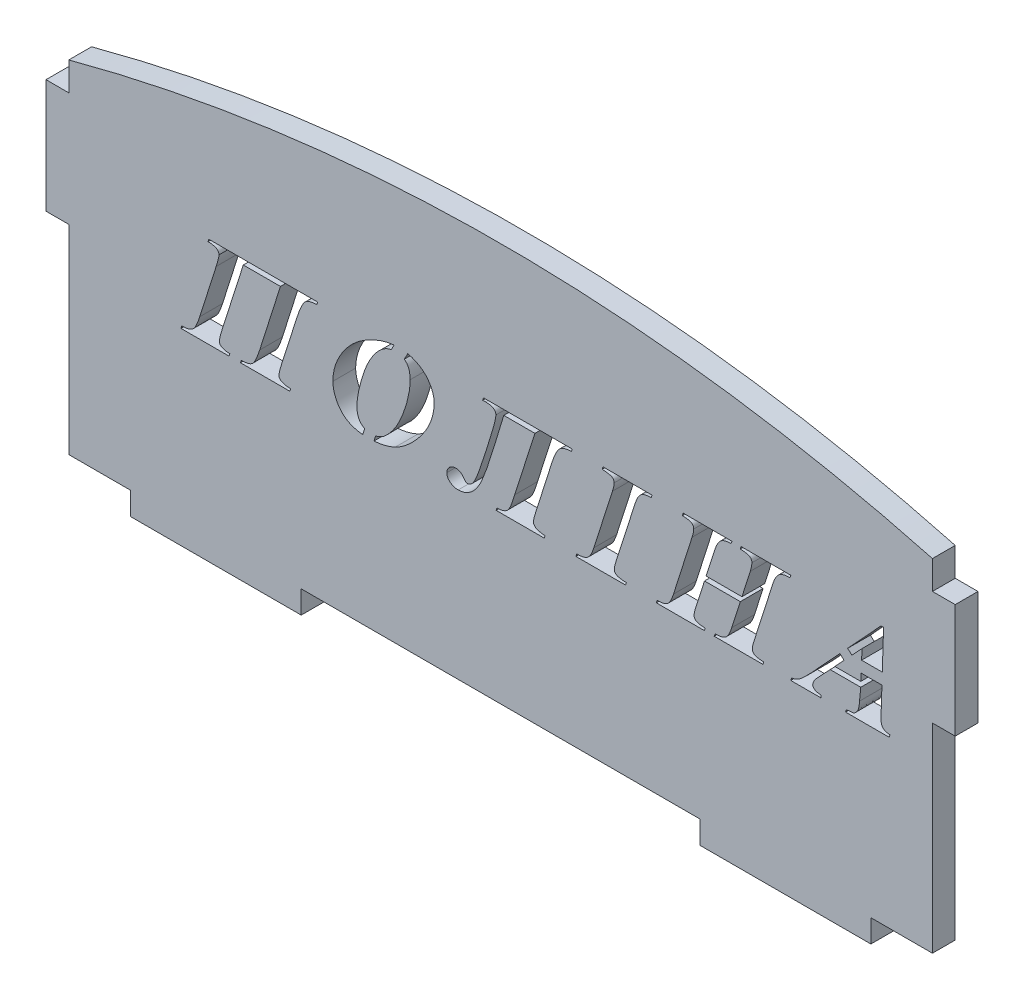
from build123d import *

# Parameters (mm, degrees)
SKETCH_1_W          = 30
SKETCH_1_H          = 4
SKETCH_1_W_2        = 4
SKETCH_1_H_2        = 20
EXTRUDE_1_DEPTH     = 4
CUT_EXTRUDE_1_DEPTH = 171.667395832
EXTRUDE_2_DEPTH     = 4


with BuildPart() as part:
    # Эскиз1 → Бобышка-Вытянуть1 (new body)
    with BuildSketch(Plane.XY):
        with BuildLine():
            ThreePointArc((0, 60), (75.8, 70), (151.6, 60))
            Line((151.6, 60), (151.6, 0))
            Line((151.6, 0), (0, 0))
            Line((0, 0), (0, 60))
        make_face()
        with Locations((25.8, -2)):
            Rectangle(SKETCH_1_W, SKETCH_1_H)
        with Locations((125.8, -2)):
            Rectangle(SKETCH_1_W, SKETCH_1_H)
        with Locations((-2, 45)):
            Rectangle(SKETCH_1_W_2, SKETCH_1_H_2)
        with Locations((153.6, 45)):
            Rectangle(SKETCH_1_W_2, SKETCH_1_H_2)
    extrude(amount=EXTRUDE_1_DEPTH)

    # Эскиз2 → Вырез-Вытянуть1 (cut, through all)
    # profile 1 of 6: a face of its own
    with BuildSketch(Plane.XY.offset(4)):
        with BuildLine():
            Line((24.577777778, 45.033561224), (43.688888889, 45.033561224))
            Line((43.688888889, 45.033561224), (43.560416667, 44.58911678))
            add(Edge.make_bspline(
                [(43.560416667, 44.58911678), (43.422573317, 44.581436375), (43.157719587, 44.56667916), (42.777443925, 44.520166149), (42.433427294, 44.444183595), (42.124413616, 44.344322742), (41.852446958, 44.218410528), (41.61153867, 44.074350744), (41.410902799, 43.897747493), (41.243672908, 43.692460863), (41.098482404, 43.456632733), (40.952262669, 43.190822398), (40.802483546, 42.889064415), (40.656640494, 42.547217024), (40.496813408, 42.173764821), (40.347197166, 41.758239061), (40.18998724, 41.307133263), (40.088672555, 40.992124662), (40.036111111, 40.828700113)],
                knots=[0, 0, 0, 0, 1.165264992, 2.23895298, 3.229786544, 4.135036914, 4.974355311, 5.755229405, 6.496018731, 7.217816154, 7.982134479, 8.830502393, 9.77865426, 10.824236485, 11.967337008, 13.206906941, 14.550960284, 16, 16, 16, 16], degree=3))
            Line((40.036111111, 40.828700113), (37.313888889, 32.293977891))
            add(Edge.make_bspline(
                [(37.313888889, 32.293977891), (37.280906823, 32.187664662), (37.217632677, 31.983709014), (37.136075295, 31.688858548), (37.061667821, 31.422171042), (37.002760192, 31.182483794), (36.955899617, 30.969668405), (36.926255078, 30.782785453), (36.902067301, 30.622124723), (36.898742048, 30.523213571), (36.897222222, 30.478005668)],
                knots=[0, 0, 0, 0, 1.430195329, 2.743745252, 3.930719129, 4.987578332, 5.915147374, 6.729316849, 7.419227069, 8, 8, 8, 8], degree=3))
            add(Edge.make_bspline(
                [(36.897222222, 30.478005668), (36.902406699, 30.404867824), (36.912624859, 30.26071938), (37.021332396, 30.065140051), (37.183652055, 29.895677071), (37.416590081, 29.763014092), (37.705141375, 29.649710838), (38.058307345, 29.566126855), (38.471678594, 29.503722935), (38.769651717, 29.486947188), (38.928472222, 29.478005668)],
                knots=[0, 0, 0, 0, 0.702343681, 1.384259415, 2.113725787, 2.953924595, 3.955253759, 5.110818597, 6.460058258, 8, 8, 8, 8], degree=3))
            Line((38.928472222, 29.478005668), (38.8, 29.033561224))
            Line((38.8, 29.033561224), (30.133333333, 29.033561224))
            Line((30.133333333, 29.033561224), (30.272222222, 29.478005668))
            add(Edge.make_bspline(
                [(30.272222222, 29.478005668), (30.391450971, 29.480563315), (30.619745459, 29.485460597), (30.948428258, 29.50701051), (31.247082477, 29.554307437), (31.519017307, 29.609666247), (31.760143211, 29.689490797), (31.96979695, 29.78813057), (32.154844192, 29.896918566), (32.31044256, 30.037439763), (32.454295846, 30.208373948), (32.594320912, 30.421959595), (32.740561494, 30.680535272), (32.887861593, 30.986456139), (33.041079952, 31.338430092), (33.195625636, 31.737497054), (33.356197092, 32.182975836), (33.458319628, 32.49737119), (33.511805556, 32.662033446)],
                knots=[0, 0, 0, 0, 1.130023369, 2.163723997, 3.117553014, 3.993016472, 4.790632551, 5.516740744, 6.186323123, 6.815629206, 7.492446661, 8.298462087, 9.231577466, 10.305673929, 11.513826383, 12.868083061, 14.359681528, 16, 16, 16, 16], degree=3))
            Line((33.511805556, 32.662033446), (37.150694444, 44.144672335))
            Line((37.150694444, 44.144672335), (30.633333333, 44.144672335))
            Line((30.633333333, 44.144672335), (26.914583333, 32.467589002))
            add(Edge.make_bspline(
                [(26.914583333, 32.467589002), (26.877186226, 32.345008269), (26.80568995, 32.110656831), (26.709035781, 31.773685785), (26.623761817, 31.469991539), (26.56104176, 31.197821125), (26.49968265, 30.962363052), (26.469383631, 30.757116517), (26.439709271, 30.586457221), (26.436743226, 30.482730592), (26.435416667, 30.436339002)],
                knots=[0, 0, 0, 0, 1.470386622, 2.81110425, 4.022393801, 5.088493372, 6.016169153, 6.810842172, 7.468150825, 8, 8, 8, 8], degree=3))
            add(Edge.make_bspline(
                [(26.435416667, 30.436339002), (26.439969258, 30.364678039), (26.448858214, 30.224759659), (26.544099099, 30.03068058), (26.695838621, 29.867794159), (26.905213141, 29.736357008), (27.166784692, 29.628688617), (27.486703486, 29.553065539), (27.861882979, 29.497251819), (28.131942379, 29.4846915), (28.275694444, 29.478005668)],
                knots=[0, 0, 0, 0, 0.746538604, 1.457620257, 2.213469515, 3.054867674, 4.028423999, 5.167380879, 6.492202649, 8, 8, 8, 8], degree=3))
            Line((28.275694444, 29.478005668), (28.133333333, 29.033561224))
            Line((28.133333333, 29.033561224), (19.688888889, 29.033561224))
            Line((19.688888889, 29.033561224), (19.83125, 29.478005668))
            add(Edge.make_bspline(
                [(19.83125, 29.478005668), (19.9389481, 29.481557788), (20.147727633, 29.488443796), (20.447993442, 29.515906128), (20.725248245, 29.557232852), (20.979146959, 29.613107654), (21.212126131, 29.67904485), (21.41806279, 29.769270557), (21.604808373, 29.863941831), (21.772008688, 29.983353968), (21.925811514, 30.136841814), (22.078301857, 30.328257296), (22.227700917, 30.569645025), (22.377627951, 30.85759473), (22.534983937, 31.189912115), (22.685454228, 31.571860876), (22.843062845, 31.998268226), (22.940113975, 32.301657682), (22.990972222, 32.460644557)],
                knots=[0, 0, 0, 0, 1.072010987, 2.078160646, 2.998388562, 3.8590385, 4.664277817, 5.40222355, 6.092532591, 6.744504629, 7.436732265, 8.247879266, 9.174426911, 10.256290016, 11.477294972, 12.830993111, 14.339327581, 16, 16, 16, 16], degree=3))
            Line((22.990972222, 32.460644557), (25.869444444, 41.537033446))
            add(Edge.make_bspline(
                [(25.869444444, 41.537033446), (25.908217438, 41.657224396), (25.982185109, 41.88651401), (26.078855019, 42.216956539), (26.161631825, 42.514577823), (26.233161584, 42.778867946), (26.285035718, 43.012028981), (26.323138991, 43.213445053), (26.350811753, 43.38234615), (26.354103742, 43.484873139), (26.355555556, 43.530089002)],
                knots=[0, 0, 0, 0, 1.473799708, 2.811584128, 4.017612185, 5.079130301, 6.006533427, 6.803931455, 7.472516732, 8, 8, 8, 8], degree=3))
            add(Edge.make_bspline(
                [(26.355555556, 43.530089002), (26.349868104, 43.613216186), (26.338837873, 43.774432844), (26.242780865, 43.99891033), (26.08780418, 44.188741551), (25.870068821, 44.340678217), (25.593016192, 44.451631339), (25.260102934, 44.533784448), (24.867230941, 44.579872565), (24.586000439, 44.585893105), (24.435416667, 44.58911678)],
                knots=[0, 0, 0, 0, 0.810382873, 1.571654571, 2.344460079, 3.180311087, 4.13931611, 5.248819674, 6.526891263, 8, 8, 8, 8], degree=3))
            Line((24.435416667, 44.58911678), (24.577777778, 45.033561224))
        make_face()
    # profile 2 of 6: a face of its own
    with BuildSketch(Plane.XY.offset(4)):
        with BuildLine():
            add(Edge.make_bspline(
                [(52.452777778, 28.811339002), (52.277913253, 28.812525445), (51.9369921, 28.814838569), (51.440132214, 28.856330407), (50.967613431, 28.912180523), (50.521753594, 29.000449911), (50.10006277, 29.106519675), (49.704415901, 29.237915717), (49.33687712, 29.399519893), (48.990156151, 29.578467673), (48.672489828, 29.786450675), (48.37035641, 30.00416997), (48.093081994, 30.244994627), (47.835225976, 30.502324846), (47.598166584, 30.777268808), (47.383198082, 31.071033499), (47.183349234, 31.378622147), (46.957737286, 31.811390151), (46.718673124, 32.358170204), (46.514073531, 33.021003562), (46.380139359, 33.675181431), (46.363676492, 34.110493573), (46.355555556, 34.325227891)],
                knots=[0, 0, 0, 0, 1.133703942, 2.210303407, 3.231682923, 4.218037087, 5.155657709, 6.050568803, 6.917950344, 7.757369474, 8.57777786, 9.378020583, 10.171048668, 10.956616573, 11.739058077, 12.522758828, 13.316106589, 14.115327674, 15.68547691, 17.178891518, 18.60838064, 20, 20, 20, 20], degree=3))
            add(Edge.make_bspline(
                [(46.355555556, 34.325227891), (46.359671058, 34.539615504), (46.367952842, 34.971035959), (46.453530853, 35.617169782), (46.580299206, 36.265231766), (46.763217088, 36.913599154), (46.996191705, 37.563365645), (47.282153886, 38.213943094), (47.621501491, 38.864625804), (48.006678182, 39.51285987), (48.438678318, 40.144459197), (48.908400042, 40.749559582), (49.411488001, 41.3248861), (49.955903346, 41.862532144), (50.532161836, 42.372116371), (51.149152266, 42.843457633), (51.799433237, 43.285190797), (52.478828809, 43.6920683), (53.175967359, 44.057394635), (53.876371199, 44.378674269), (54.576985498, 44.644790974), (55.271029661, 44.870645209), (55.965718058, 45.039385494), (56.656189039, 45.166558398), (57.346948474, 45.241405431), (57.806771001, 45.250998718), (58.036111111, 45.255783446)],
                knots=[0, 0, 0, 0, 0.880052281, 1.770963121, 2.672463906, 3.590543835, 4.534808223, 5.505447027, 6.506852452, 7.547106529, 8.600592435, 9.647483332, 10.691661805, 11.737040664, 12.787927938, 13.849011852, 14.923565314, 16.015174839, 17.099587852, 18.154724101, 19.177916315, 20.176134954, 21.150363974, 22.111692441, 23.058191721, 24, 24, 24, 24], degree=3))
            add(Edge.make_bspline(
                [(58.036111111, 45.255783446), (58.301796693, 45.2474624), (58.828570365, 45.230964297), (59.606116804, 45.087489177), (60.364503555, 44.868872111), (60.968844745, 44.601234158), (61.436152109, 44.355789305), (61.76476076, 44.144437435), (62.080353357, 43.924431108), (62.370032879, 43.679735934), (62.64425278, 43.422728518), (62.893700434, 43.144029313), (63.12341268, 42.847329391), (63.400875831, 42.437940832), (63.691788891, 41.908795753), (63.941929419, 41.255601142), (64.106647382, 40.599547424), (64.124494065, 40.158337631), (64.133333333, 39.939811224)],
                knots=[0, 0, 0, 0, 1.422541936, 2.820467848, 4.22361197, 5.64305452, 6.353364942, 7.050226681, 7.735146345, 8.413293401, 9.080115285, 9.747629013, 10.4150563, 11.089363871, 12.396586428, 13.63935404, 14.830797759, 16, 16, 16, 16], degree=3))
            add(Edge.make_bspline(
                [(64.133333333, 39.939811224), (64.127931833, 39.695222953), (64.117083007, 39.20397137), (64.008915907, 38.468101345), (63.848265533, 37.731099533), (63.615402085, 36.994428769), (63.319583981, 36.25733817), (62.956340802, 35.519853735), (62.527600765, 34.782484116), (62.038126892, 34.055622708), (61.509865077, 33.35381653), (60.961576463, 32.691332653), (60.394177818, 32.081933192), (59.810150458, 31.523130781), (59.214518828, 31.009214092), (58.596029662, 30.554447059), (57.964576454, 30.143879885), (57.525176152, 29.910091019), (57.306944444, 29.793977891)],
                knots=[0, 0, 0, 0, 0.918505764, 1.844803956, 2.789211362, 3.750728413, 4.744098265, 5.771087998, 6.837056519, 7.946798197, 9.061921451, 10.136646433, 11.176758069, 12.188765959, 13.172799745, 14.130502664, 15.071499052, 16, 16, 16, 16], degree=3))
            add(Edge.make_bspline(
                [(57.306944444, 29.793977891), (57.137705235, 29.715529907), (56.795631241, 29.556967272), (56.258312807, 29.354083566), (55.690686764, 29.190285853), (55.096511144, 29.050276537), (54.474899921, 28.943403623), (53.825711166, 28.868718777), (53.149216312, 28.816997763), (52.687832624, 28.813248889), (52.452777778, 28.811339002)],
                knots=[0, 0, 0, 0, 0.89598997, 1.811015718, 2.755848471, 3.732350636, 4.742484928, 5.783935774, 6.871012023, 8, 8, 8, 8], degree=3))
        make_face()
        with BuildLine():
            add(Edge.make_bspline(
                [(57.598611111, 44.366894557), (57.43404577, 44.363209239), (57.116373267, 44.3560952), (56.65894179, 44.292913908), (56.239134216, 44.190119063), (55.850125823, 44.041457186), (55.481942176, 43.838519998), (55.109152998, 43.590211808), (54.735180229, 43.278031098), (54.343148031, 42.916020042), (53.954172851, 42.476761318), (53.560402563, 41.959503597), (53.167565969, 41.356349887), (52.840856168, 40.798571677), (52.580445573, 40.304167519), (52.388654134, 39.890034346), (52.192338493, 39.447145837), (52.006609441, 38.968383912), (51.818817723, 38.459532566), (51.63474147, 37.916525502), (51.454895635, 37.340916028), (51.281331183, 36.742096367), (51.115532282, 36.142252054), (50.973845582, 35.557109858), (50.850327566, 34.998496647), (50.754296641, 34.464211555), (50.676487674, 33.956037586), (50.621536615, 33.474225973), (50.583377761, 33.017972221), (50.579608307, 32.722289914), (50.577777778, 32.578700113)],
                knots=[0, 0, 0, 0, 0.929487154, 1.794256975, 2.603191595, 3.367123199, 4.139600881, 4.973963596, 5.894248367, 6.889015047, 7.986638611, 9.204403412, 10.559352132, 12.051154573, 12.855582558, 13.715690781, 14.629399173, 15.592446035, 16.616616423, 17.694104889, 18.831737857, 20.023821523, 21.216873503, 22.347813622, 23.425321934, 24.448970187, 25.414567289, 26.32960876, 27.188821451, 28, 28, 28, 28], degree=3))
            add(Edge.make_bspline(
                [(50.577777778, 32.578700113), (50.579772319, 32.464062753), (50.58364841, 32.241282299), (50.613741864, 31.917010849), (50.670586408, 31.615814129), (50.74202489, 31.333580937), (50.839114451, 31.074252567), (50.956696901, 30.836012793), (51.09844063, 30.621854448), (51.256513712, 30.427256264), (51.43561484, 30.257024564), (51.625894121, 30.107513836), (51.829044303, 29.980381034), (52.045737204, 29.880668921), (52.272387243, 29.800413997), (52.510386842, 29.740428618), (52.761893616, 29.70515442), (52.934145953, 29.70189467), (53.022222222, 29.700227891)],
                knots=[0, 0, 0, 0, 1.288196855, 2.503416699, 3.65392539, 4.729665906, 5.770886781, 6.75969405, 7.708427821, 8.650990174, 9.5708456, 10.478855311, 11.366707539, 12.25693816, 13.153700413, 14.06533567, 15.01076514, 16, 16, 16, 16], degree=3))
            add(Edge.make_bspline(
                [(53.022222222, 29.700227891), (53.138056762, 29.703157081), (53.366880614, 29.708943513), (53.703942606, 29.746973139), (54.028220391, 29.812854774), (54.338852748, 29.906529078), (54.634426161, 30.029333656), (54.917852563, 30.174995972), (55.186495197, 30.350011964), (55.354275103, 30.483568087), (55.438888889, 30.550922335)],
                knots=[0, 0, 0, 0, 1.061841361, 2.097600873, 3.10470616, 4.091486603, 5.066792466, 6.03485765, 7.00895084, 8, 8, 8, 8], degree=3))
            add(Edge.make_bspline(
                [(55.438888889, 30.550922335), (55.602311663, 30.697620711), (55.933443107, 30.994864747), (56.390321898, 31.496771806), (56.829733245, 32.043351829), (57.244983256, 32.639684486), (57.634939808, 33.286731359), (58.00273828, 33.982616889), (58.348612688, 34.728044718), (58.666926873, 35.511171323), (58.952284086, 36.307478242), (59.213296485, 37.08926475), (59.422430566, 37.853232811), (59.603713912, 38.591992879), (59.736074968, 39.311371274), (59.841470545, 40.005530031), (59.896385325, 40.678499628), (59.906259271, 41.119129004), (59.911111111, 41.335644557)],
                knots=[0, 0, 0, 0, 0.880585545, 1.784265164, 2.719048896, 3.692909943, 4.697129502, 5.74821306, 6.84928163, 7.992697359, 9.138439681, 10.242705472, 11.298353862, 12.31538557, 13.293510545, 14.23193176, 15.131210277, 16, 16, 16, 16], degree=3))
            add(Edge.make_bspline(
                [(59.911111111, 41.335644557), (59.9092528, 41.464182979), (59.905664172, 41.712406552), (59.874311585, 42.070889912), (59.82262482, 42.402831586), (59.75133644, 42.707627588), (59.657699853, 42.98478656), (59.541923671, 43.233519222), (59.408811123, 43.457498837), (59.198884816, 43.708235461), (58.910104229, 43.974796467), (58.507399015, 44.19978764), (58.066530547, 44.34343283), (57.757149374, 44.358945365), (57.598611111, 44.366894557)],
                knots=[0, 0, 0, 0, 1.073465636, 2.072994778, 3.002768943, 3.877381987, 4.684473903, 5.44137101, 6.165905093, 6.85289807, 8.167157467, 9.422608508, 10.679250043, 12, 12, 12, 12], degree=3))
        make_face(mode=Mode.SUBTRACT)
    # profile 3 of 6: a face of its own
    with BuildSketch(Plane.XY.offset(4)):
        with BuildLine():
            Line((88.355555556, 45.033561224), (88.227083333, 44.58911678))
            add(Edge.make_bspline(
                [(88.227083333, 44.58911678), (88.096154703, 44.582794561), (87.845167388, 44.570675007), (87.485526715, 44.524911493), (87.157345208, 44.460878344), (86.860122007, 44.371262457), (86.594861022, 44.256263593), (86.360402034, 44.121741837), (86.157744997, 43.9639026), (85.98904835, 43.777492195), (85.837171393, 43.565481875), (85.690175902, 43.326247403), (85.539486666, 43.058679059), (85.394368481, 42.757521968), (85.249437529, 42.426337759), (85.107569649, 42.063195721), (84.964895032, 41.670799594), (84.874511972, 41.397234975), (84.827777778, 41.255783446)],
                knots=[0, 0, 0, 0, 1.200210764, 2.300777731, 3.317425419, 4.259723734, 5.138073833, 5.959908809, 6.729778898, 7.479983189, 8.253929774, 9.115812375, 10.050747235, 11.065347849, 12.176180288, 13.361267383, 14.635595623, 16, 16, 16, 16], degree=3))
            Line((84.827777778, 41.255783446), (81.942361111, 32.15161678))
            add(Edge.make_bspline(
                [(81.942361111, 32.15161678), (81.887664607, 31.976104728), (81.78744092, 31.654503467), (81.670795544, 31.210377352), (81.599074068, 30.84826061), (81.584199119, 30.633301141), (81.577777778, 30.540505668)],
                knots=[0, 0, 0, 0, 1.33166645, 2.440092326, 3.326606212, 4, 4, 4, 4], degree=3))
            add(Edge.make_bspline(
                [(81.577777778, 30.540505668), (81.583206066, 30.464104528), (81.593962123, 30.31271704), (81.699042254, 30.104697534), (81.864605841, 29.927534407), (82.095062053, 29.782652083), (82.38542711, 29.663860197), (82.73802376, 29.571676295), (83.152174344, 29.507347467), (83.450221294, 29.488205149), (83.609027778, 29.478005668)],
                knots=[0, 0, 0, 0, 0.724373118, 1.435332331, 2.169729539, 3.014763416, 4.009121512, 5.152539275, 6.48280539, 8, 8, 8, 8], degree=3))
            Line((83.609027778, 29.478005668), (83.466666667, 29.033561224))
            Line((83.466666667, 29.033561224), (75.022222222, 29.033561224))
            Line((75.022222222, 29.033561224), (75.161111111, 29.478005668))
            add(Edge.make_bspline(
                [(75.161111111, 29.478005668), (75.302434672, 29.48139591), (75.570953176, 29.487837458), (75.949918232, 29.533785683), (76.281122579, 29.61722832), (76.570655911, 29.731941516), (76.823193326, 29.888388883), (77.043874438, 30.085683998), (77.235597434, 30.322631545), (77.377537136, 30.551033736), (77.479457156, 30.77092073), (77.570538929, 30.97502566), (77.666379805, 31.220365246), (77.776139534, 31.503549593), (77.882173335, 31.830666234), (78.011240501, 32.191901406), (78.141918626, 32.595179495), (78.229726968, 32.878368138), (78.275694444, 33.02661678)],
                knots=[0, 0, 0, 0, 1.294790177, 2.460135592, 3.488900396, 4.416383178, 5.30212979, 6.195964426, 7.115165946, 8.086356276, 8.650771119, 9.334470443, 10.133940446, 11.063542499, 12.116506676, 13.283539496, 14.577938805, 16, 16, 16, 16], degree=3))
            Line((78.275694444, 33.02661678), (81.820833333, 44.144672335))
            Line((81.820833333, 44.144672335), (76.355555556, 44.144672335))
            Line((76.355555556, 44.144672335), (74.668055556, 38.575227891))
            add(Edge.make_bspline(
                [(74.668055556, 38.575227891), (74.584210137, 38.296093896), (74.420117735, 37.749805635), (74.168596837, 36.952007637), (73.92791616, 36.191577203), (73.685964119, 35.471639346), (73.45486986, 34.789391681), (73.230202218, 34.1461849), (73.006424124, 33.543669453), (72.789148614, 32.977732598), (72.571495703, 32.448243873), (72.346765706, 31.957045217), (72.110248486, 31.505772685), (71.867319662, 31.089845037), (71.614279431, 30.712049988), (71.354528303, 30.369003239), (71.0822562, 30.066455809), (70.804352986, 29.797707419), (70.519371388, 29.563071971), (70.225340918, 29.366016898), (69.930030683, 29.193075024), (69.626472121, 29.053754745), (69.317165895, 28.94543836), (69.001784209, 28.869968452), (68.682542373, 28.817490772), (68.46687635, 28.813389789), (68.359027778, 28.811339002)],
                knots=[0, 0, 0, 0, 1.694919763, 3.317097832, 4.864623832, 6.333277377, 7.733845331, 9.053676679, 10.295241315, 11.47146674, 12.578953285, 13.623993115, 14.61148096, 15.540753509, 16.423753506, 17.254380346, 18.040854242, 18.788221717, 19.500961791, 20.1842348, 20.844613711, 21.489126076, 22.123471266, 22.747084211, 23.373451708, 24, 24, 24, 24], degree=3))
            add(Edge.make_bspline(
                [(68.359027778, 28.811339002), (68.225262846, 28.815510257), (67.964852794, 28.823630746), (67.592283466, 28.920828129), (67.244803156, 29.060439269), (66.940129268, 29.266018015), (66.681463562, 29.508214895), (66.491592159, 29.787240812), (66.377841453, 30.097024683), (66.363069532, 30.312728759), (66.355555556, 30.422450113)],
                knots=[0, 0, 0, 0, 1.123056119, 2.186336132, 3.221254487, 4.261523892, 5.260606146, 6.187392429, 7.077987954, 8, 8, 8, 8], degree=3))
            add(Edge.make_bspline(
                [(66.355555556, 30.422450113), (66.360058386, 30.520500703), (66.368999392, 30.715194003), (66.466782809, 30.992483081), (66.610016264, 31.253875513), (66.816199884, 31.481595395), (67.061665925, 31.678421988), (67.345240518, 31.821218676), (67.660663505, 31.90838992), (67.880435359, 31.917647592), (67.994444444, 31.922450113)],
                knots=[0, 0, 0, 0, 0.949022027, 1.884417328, 2.826079891, 3.830153279, 4.847182181, 5.868245327, 6.894128625, 8, 8, 8, 8], degree=3))
            add(Edge.make_bspline(
                [(67.994444444, 31.922450113), (68.058244286, 31.919314764), (68.183307428, 31.91316872), (68.368478337, 31.878103942), (68.545002012, 31.815520312), (68.714166841, 31.725800331), (68.877629287, 31.61579109), (69.032044942, 31.476322095), (69.180439938, 31.315166873), (69.268795181, 31.193088413), (69.313888889, 31.130783446)],
                knots=[0, 0, 0, 0, 0.954772232, 1.871584834, 2.807969957, 3.744995124, 4.729446844, 5.747431565, 6.850360653, 8, 8, 8, 8], degree=3))
            add(Edge.make_bspline(
                [(69.313888889, 31.130783446), (69.372056005, 31.050300224), (69.477309563, 30.90466561), (69.646295122, 30.731521874), (69.808786735, 30.615817274), (69.922609398, 30.597378731), (69.973611111, 30.58911678)],
                knots=[0, 0, 0, 0, 1.351143805, 2.444898479, 3.303189376, 4, 4, 4, 4], degree=3))
            add(Edge.make_bspline(
                [(69.973611111, 30.58911678), (70.040165314, 30.592843103), (70.174289106, 30.600352601), (70.370356786, 30.672459502), (70.559910431, 30.785224268), (70.74053631, 30.946186956), (70.917433068, 31.146233655), (71.09309658, 31.387904678), (71.256156119, 31.677941037), (71.390072461, 31.948761055), (71.498952535, 32.194660979), (71.588015535, 32.409310341), (71.686356836, 32.64802445), (71.78479338, 32.913698613), (71.898040605, 33.200201495), (72.011825574, 33.514625535), (72.132655008, 33.853987812), (72.262362381, 34.217756237), (72.391785815, 34.608305683), (72.537668675, 35.020679524), (72.679114211, 35.461592465), (72.83954419, 35.923546234), (72.996422958, 36.413303001), (73.164928204, 36.926226744), (73.333312046, 37.46688072), (73.51216051, 38.021507565), (73.685878979, 38.576239905), (73.853157961, 39.109262978), (74.005704441, 39.614326611), (74.147721854, 40.08896873), (74.279996829, 40.534470255), (74.402232739, 40.949462043), (74.509011293, 41.336607608), (74.608415428, 41.693392715), (74.688481696, 42.0235377), (74.768353516, 42.321883372), (74.828675102, 42.592383576), (74.883233451, 42.832417398), (74.920341177, 43.043609828), (74.948898417, 43.225242917), (74.967723026, 43.378098898), (74.971787155, 43.471023775), (74.973611111, 43.512727891)],
                knots=[0, 0, 0, 0, 0.560900923, 1.130359246, 1.744639534, 2.417621033, 3.166128954, 4.000034163, 4.93834579, 5.975601126, 6.553904313, 7.211846426, 7.94058078, 8.736646706, 9.607187347, 10.545294816, 11.563681343, 12.653173765, 13.810607882, 15.042360439, 16.351421935, 17.7254824, 19.176926102, 20.699568517, 22.290436653, 23.96480916, 25.62689611, 27.205496167, 28.688403003, 30.087877937, 31.394559552, 32.617846892, 33.745693937, 34.790263859, 35.749171332, 36.617894845, 37.401287905, 38.09231425, 38.698906906, 39.213781558, 39.647149982, 40, 40, 40, 40], degree=3))
            add(Edge.make_bspline(
                [(74.973611111, 43.512727891), (74.969138984, 43.598045187), (74.960539286, 43.762106464), (74.869286284, 43.991171505), (74.715774845, 44.180317008), (74.508992804, 44.336370648), (74.241143897, 44.448170854), (73.921704764, 44.534710589), (73.543103129, 44.579349701), (73.273470492, 44.585722536), (73.129861111, 44.58911678)],
                knots=[0, 0, 0, 0, 0.850203861, 1.634903328, 2.41780724, 3.260648519, 4.198696877, 5.302434672, 6.563246304, 8, 8, 8, 8], degree=3))
            Line((73.129861111, 44.58911678), (72.657638889, 44.58911678))
            Line((72.657638889, 44.58911678), (72.8, 45.033561224))
            Line((72.8, 45.033561224), (88.355555556, 45.033561224))
        make_face()
    # profile 4 of 6: a face of its own
    with BuildSketch(Plane.XY.offset(4)):
        with BuildLine():
            Line((93.640277778, 44.58911678), (93.782638889, 45.033561224))
            Line((93.782638889, 45.033561224), (102.39375, 45.033561224))
            Line((102.39375, 45.033561224), (102.227083333, 44.58911678))
            add(Edge.make_bspline(
                [(102.227083333, 44.58911678), (102.043690419, 44.585407107), (101.698648346, 44.578427594), (101.215219872, 44.48456957), (100.795061836, 44.345327923), (100.497057139, 44.163939532), (100.291181422, 43.983242587), (100.147102479, 43.814304817), (100.00392254, 43.61655406), (99.87077124, 43.383879213), (99.732972859, 43.125794135), (99.611085872, 42.829468619), (99.484192303, 42.505553032), (99.41092054, 42.274782683), (99.372916667, 42.155089002)],
                knots=[0, 0, 0, 0, 1.592856111, 2.996857207, 4.267440655, 5.424395025, 6.002170813, 6.644346627, 7.351293752, 8.123158698, 8.974286896, 9.894437077, 10.907907464, 12, 12, 12, 12], degree=3))
            Line((99.372916667, 42.155089002), (96.098611111, 31.912033446))
            add(Edge.make_bspline(
                [(96.098611111, 31.912033446), (96.046581056, 31.74682205), (95.952369079, 31.447670106), (95.840114613, 31.040838952), (95.766218881, 30.723617499), (95.753238416, 30.539572005), (95.747916667, 30.46411678)],
                knots=[0, 0, 0, 0, 1.391354053, 2.519355678, 3.392963402, 4, 4, 4, 4], degree=3))
            add(Edge.make_bspline(
                [(95.747916667, 30.46411678), (95.752877219, 30.397593197), (95.762538846, 30.26802575), (95.830279644, 30.084107692), (95.949383167, 29.925643303), (96.056860405, 29.848040671), (96.1125, 29.80786678)],
                knots=[0, 0, 0, 0, 1.016939935, 1.980685747, 2.954626786, 4, 4, 4, 4], degree=3))
            add(Edge.make_bspline(
                [(96.1125, 29.80786678), (96.154669553, 29.782243487), (96.244878911, 29.727429989), (96.403372438, 29.668754382), (96.583656179, 29.61215825), (96.79057892, 29.567672238), (97.022791924, 29.534653051), (97.281060987, 29.507049386), (97.564724064, 29.485496584), (97.76292105, 29.480568166), (97.865972222, 29.478005668)],
                knots=[0, 0, 0, 0, 0.655438631, 1.402118179, 2.240300705, 3.171063853, 4.2147064, 5.361400637, 6.628078251, 8, 8, 8, 8], degree=3))
            Line((97.865972222, 29.478005668), (97.7375, 29.033561224))
            Line((97.7375, 29.033561224), (89.015277778, 29.033561224))
            Line((89.015277778, 29.033561224), (89.157638889, 29.478005668))
            add(Edge.make_bspline(
                [(89.157638889, 29.478005668), (89.263008221, 29.479183786), (89.465865817, 29.481451903), (89.759028153, 29.503049018), (90.030984958, 29.535428178), (90.280785397, 29.589420329), (90.510208091, 29.649858774), (90.718402387, 29.72557217), (90.901417682, 29.821155477), (91.072659284, 29.92541514), (91.223797582, 30.063630135), (91.371399249, 30.228097916), (91.511112971, 30.42871194), (91.656309903, 30.656170357), (91.784855622, 30.924515297), (91.917931831, 31.222347692), (92.045212636, 31.555453107), (92.12379902, 31.790203848), (92.164583333, 31.912033446)],
                knots=[0, 0, 0, 0, 1.179000701, 2.269818386, 3.288415749, 4.241050232, 5.127166548, 5.942789433, 6.713243445, 7.435477842, 8.178777054, 8.995222347, 9.904698396, 10.911116394, 12.011733874, 13.229584263, 14.56222547, 16, 16, 16, 16], degree=3))
            Line((92.164583333, 31.912033446), (95.435416667, 42.155089002))
            add(Edge.make_bspline(
                [(95.435416667, 42.155089002), (95.481106487, 42.301616383), (95.566169603, 42.574414029), (95.659470069, 42.959287718), (95.721721181, 43.287344493), (95.730205803, 43.488215803), (95.734027778, 43.578700113)],
                knots=[0, 0, 0, 0, 1.261569847, 2.34873019, 3.256170483, 4, 4, 4, 4], degree=3))
            add(Edge.make_bspline(
                [(95.734027778, 43.578700113), (95.728968797, 43.647427351), (95.719115737, 43.781283103), (95.653184842, 43.972264352), (95.530553683, 44.132342142), (95.396894481, 44.248567139), (95.255591135, 44.323658549), (95.117842992, 44.380349647), (94.948438014, 44.426325989), (94.747649932, 44.467743502), (94.515816273, 44.504835688), (94.252009335, 44.540237461), (93.956475357, 44.566544029), (93.749095907, 44.581348458), (93.640277778, 44.58911678)],
                knots=[0, 0, 0, 0, 0.959918819, 1.869573972, 2.771158515, 3.745517072, 4.316735434, 4.997804048, 5.821151466, 6.762258638, 7.859235875, 9.097713163, 10.477084281, 12, 12, 12, 12], degree=3))
        make_face()
    # profile 5 of 6: a face of its own
    with BuildSketch(Plane.XY.offset(4)):
        with BuildLine():
            Line((111.872916667, 37.478005668), (118.164583333, 37.478005668))
            Line((118.164583333, 37.478005668), (119.622916667, 42.068283446))
            add(Edge.make_bspline(
                [(119.622916667, 42.068283446), (119.665983884, 42.21606465), (119.746292107, 42.491634949), (119.837474658, 42.879410744), (119.894832977, 43.212421256), (119.903636879, 43.416491154), (119.907638889, 43.509255668)],
                knots=[0, 0, 0, 0, 1.253577487, 2.337568749, 3.244304877, 4, 4, 4, 4], degree=3))
            add(Edge.make_bspline(
                [(119.907638889, 43.509255668), (119.904439357, 43.586189099), (119.898339084, 43.732871457), (119.829657311, 43.938803012), (119.714834713, 44.113231855), (119.584115018, 44.23494027), (119.449907107, 44.31936379), (119.313907605, 44.371802031), (119.148127451, 44.418626203), (118.954703035, 44.469930927), (118.728596663, 44.503821904), (118.473190681, 44.540842711), (118.186770813, 44.56627668), (117.985197477, 44.581277688), (117.879861111, 44.58911678)],
                knots=[0, 0, 0, 0, 1.071309548, 2.042573814, 2.988623831, 3.96082931, 4.512584939, 5.194024783, 5.986784092, 6.919901531, 7.985586085, 9.176673759, 10.524611784, 12, 12, 12, 12], degree=3))
            Line((117.879861111, 44.58911678), (118.022222222, 45.033561224))
            Line((118.022222222, 45.033561224), (126.751388889, 45.033561224))
            Line((126.751388889, 45.033561224), (126.609027778, 44.58911678))
            add(Edge.make_bspline(
                [(126.609027778, 44.58911678), (126.408364623, 44.584259328), (126.030949836, 44.57512325), (125.501012537, 44.478279006), (125.047597392, 44.317210291), (124.720741738, 44.125055913), (124.505614419, 43.923900744), (124.346694395, 43.749717855), (124.200136349, 43.540144646), (124.056282448, 43.30118743), (123.918399373, 43.030802448), (123.787116015, 42.727878438), (123.661860746, 42.394127211), (123.588191168, 42.158951353), (123.55, 42.037033446)],
                knots=[0, 0, 0, 0, 1.642374982, 3.089040463, 4.390692794, 5.569541615, 6.160089592, 6.797836872, 7.497675205, 8.25047912, 9.08154031, 9.981605589, 10.953640805, 12, 12, 12, 12], degree=3))
            Line((123.55, 42.037033446), (120.310416667, 31.887727891))
            add(Edge.make_bspline(
                [(120.310416667, 31.887727891), (120.261341977, 31.734249748), (120.171131311, 31.45212131), (120.070373063, 31.060493789), (120.004612602, 30.738231671), (119.992721552, 30.545344445), (119.9875, 30.460644557)],
                knots=[0, 0, 0, 0, 1.317202288, 2.421323436, 3.306777693, 4, 4, 4, 4], degree=3))
            add(Edge.make_bspline(
                [(119.9875, 30.460644557), (119.990680863, 30.391679609), (119.996780843, 30.259424709), (120.066601196, 30.0764906), (120.177771875, 29.918663703), (120.281199988, 29.843361912), (120.334722222, 29.804394557)],
                knots=[0, 0, 0, 0, 1.060953562, 2.034603225, 2.982941656, 4, 4, 4, 4], degree=3))
            add(Edge.make_bspline(
                [(120.334722222, 29.804394557), (120.424782658, 29.757013332), (120.626751904, 29.650756348), (120.999259433, 29.558825663), (121.457796294, 29.499242976), (121.793948813, 29.48549533), (121.977083333, 29.478005668)],
                knots=[0, 0, 0, 0, 0.719912301, 1.614473033, 2.700374643, 4, 4, 4, 4], degree=3))
            Line((121.977083333, 29.478005668), (121.848611111, 29.033561224))
            Line((121.848611111, 29.033561224), (113.279166667, 29.033561224))
            Line((113.279166667, 29.033561224), (113.473611111, 29.478005668))
            add(Edge.make_bspline(
                [(113.473611111, 29.478005668), (113.667285967, 29.482360443), (114.028929009, 29.490491977), (114.531041142, 29.573945788), (114.955576125, 29.703699718), (115.253508249, 29.870559824), (115.455633626, 30.042291159), (115.595223278, 30.207809672), (115.73535071, 30.403580812), (115.869100464, 30.633555143), (116.001649524, 30.897036837), (116.132855567, 31.193176041), (116.256913457, 31.525822199), (116.335405924, 31.759023146), (116.376388889, 31.880783446)],
                knots=[0, 0, 0, 0, 1.667929726, 3.114473362, 4.373250097, 5.477003322, 6.028857392, 6.651069327, 7.33761492, 8.102403478, 8.94117278, 9.879144337, 10.892645907, 12, 12, 12, 12], degree=3))
            Line((116.376388889, 31.880783446), (117.876388889, 36.58911678))
            Line((117.876388889, 36.58911678), (111.591666667, 36.58911678))
            Line((111.591666667, 36.58911678), (110.084722222, 31.880783446))
            add(Edge.make_bspline(
                [(110.084722222, 31.880783446), (110.035463938, 31.730842129), (109.944048256, 31.452574463), (109.843799888, 31.061805716), (109.778581118, 30.733581129), (109.766962495, 30.534928066), (109.761805556, 30.446755668)],
                knots=[0, 0, 0, 0, 1.283737085, 2.382415541, 3.282033222, 4, 4, 4, 4], degree=3))
            add(Edge.make_bspline(
                [(109.761805556, 30.446755668), (109.766233531, 30.37896779), (109.774912077, 30.246107903), (109.851954395, 30.056925558), (109.984115648, 29.896399285), (110.161286827, 29.742917881), (110.423670231, 29.631239642), (110.768990294, 29.548179047), (111.208404133, 29.497100012), (111.532516035, 29.484755147), (111.709722222, 29.478005668)],
                knots=[0, 0, 0, 0, 0.671063145, 1.31524067, 1.986205498, 2.720096805, 3.619440058, 4.781187789, 6.240134235, 8, 8, 8, 8], degree=3))
            Line((111.709722222, 29.478005668), (111.58125, 29.033561224))
            Line((111.58125, 29.033561224), (103.133333333, 29.033561224))
            Line((103.133333333, 29.033561224), (103.275694444, 29.478005668))
            add(Edge.make_bspline(
                [(103.275694444, 29.478005668), (103.469386621, 29.482276419), (103.829919588, 29.49022587), (104.329623994, 29.574089889), (104.750212679, 29.702800938), (105.043042396, 29.870796838), (105.240503474, 30.042442997), (105.376251061, 30.208955746), (105.516855807, 30.403393252), (105.650068002, 30.633701937), (105.78365771, 30.896194647), (105.909625182, 31.19412217), (106.035026361, 31.525675389), (106.113298658, 31.758972786), (106.154166667, 31.880783446)],
                knots=[0, 0, 0, 0, 1.675556841, 3.118832639, 4.37383828, 5.465292706, 6.012100089, 6.630615379, 7.320300409, 8.088586195, 8.931191025, 9.869446081, 10.887582194, 12, 12, 12, 12], degree=3))
            Line((106.154166667, 31.880783446), (109.404166667, 42.130783446))
            add(Edge.make_bspline(
                [(109.404166667, 42.130783446), (109.447378553, 42.270402307), (109.528614415, 42.532877737), (109.619208819, 42.905867792), (109.676420109, 43.232039589), (109.684962, 43.433843305), (109.688888889, 43.52661678)],
                knots=[0, 0, 0, 0, 1.226585482, 2.305910176, 3.221190752, 4, 4, 4, 4], degree=3))
            add(Edge.make_bspline(
                [(109.688888889, 43.52661678), (109.685593566, 43.602379357), (109.67926508, 43.747877218), (109.611273562, 43.951139819), (109.499478081, 44.123170626), (109.372444212, 44.244266089), (109.238529008, 44.320380467), (109.108623012, 44.376599204), (108.948122462, 44.422162344), (108.758722633, 44.469302051), (108.538810902, 44.503849495), (108.290307443, 44.540596209), (108.012034708, 44.566537701), (107.816222264, 44.581332443), (107.713194444, 44.58911678)],
                knots=[0, 0, 0, 0, 1.080296078, 2.074649181, 3.020295258, 3.992222218, 4.548544243, 5.215679227, 6.011437105, 6.930646843, 8.005350763, 9.191968496, 10.522538431, 12, 12, 12, 12], degree=3))
            Line((107.713194444, 44.58911678), (107.855555556, 45.033561224))
            Line((107.855555556, 45.033561224), (116.428472222, 45.033561224))
            Line((116.428472222, 45.033561224), (116.234027778, 44.58911678))
            add(Edge.make_bspline(
                [(116.234027778, 44.58911678), (116.047306559, 44.583641188), (115.69683858, 44.573363731), (115.205135877, 44.484665155), (114.785783798, 44.332972267), (114.483461265, 44.15216273), (114.281164895, 43.96056464), (114.131565397, 43.787337865), (113.991190963, 43.576623784), (113.85086958, 43.334244097), (113.714319431, 43.057660399), (113.576705464, 42.747206822), (113.451684125, 42.399709669), (113.370120056, 42.156398763), (113.327777778, 42.030089002)],
                knots=[0, 0, 0, 0, 1.572649067, 2.951797047, 4.189170849, 5.314972946, 5.88773606, 6.530902164, 7.239641486, 8.017483043, 8.889798239, 9.837475462, 10.877370672, 12, 12, 12, 12], degree=3))
            Line((113.327777778, 42.030089002), (111.872916667, 37.478005668))
        make_face()
    # profile 6 of 6: a face of its own
    with BuildSketch(Plane.XY.offset(4)):
        with BuildLine():
            Line((139.022222222, 34.144672335), (133.640277778, 34.144672335))
            Line((133.640277778, 34.144672335), (132.431944444, 32.853005668))
            Line((132.431944444, 32.853005668), (131.244444444, 31.582172335))
            add(Edge.make_bspline(
                [(131.244444444, 31.582172335), (131.188213362, 31.51325526), (131.079576731, 31.380109702), (130.935056931, 31.181286028), (130.813924125, 30.991248514), (130.748238871, 30.865052027), (130.716666667, 30.804394557)],
                knots=[0, 0, 0, 0, 1.132799001, 2.188531016, 3.129301249, 4, 4, 4, 4], degree=3))
            add(Edge.make_bspline(
                [(130.716666667, 30.804394557), (130.678761763, 30.716576261), (130.604991573, 30.545665064), (130.593689325, 30.359958424), (130.588194444, 30.269672335)],
                knots=[0, 0, 0, 0, 1.027648251, 2, 2, 2, 2], degree=3))
            add(Edge.make_bspline(
                [(130.588194444, 30.269672335), (130.592200868, 30.22261192), (130.600372209, 30.126629389), (130.670758624, 29.990920064), (130.773424987, 29.860680939), (130.918894837, 29.737091791), (131.115491302, 29.632059595), (131.365360266, 29.555989003), (131.667124112, 29.500917544), (131.886534845, 29.486032851), (132.004861111, 29.478005668)],
                knots=[0, 0, 0, 0, 0.633765559, 1.292602763, 2.029205149, 2.873870715, 3.855521041, 5.024925061, 6.395568418, 8, 8, 8, 8], degree=3))
            Line((132.004861111, 29.478005668), (132.004861111, 29.033561224))
            Line((132.004861111, 29.033561224), (126.734027778, 29.033561224))
            Line((126.734027778, 29.033561224), (126.8625, 29.478005668))
            add(Edge.make_bspline(
                [(126.8625, 29.478005668), (126.976517041, 29.497433197), (127.200372692, 29.535576284), (127.520626434, 29.635605471), (127.822871489, 29.759397754), (128.009365342, 29.865986049), (128.102083333, 29.918977891)],
                knots=[0, 0, 0, 0, 1.046926797, 2.055486415, 3.033258251, 4, 4, 4, 4], degree=3))
            add(Edge.make_bspline(
                [(128.102083333, 29.918977891), (128.16634801, 29.962125113), (128.303881277, 30.054464773), (128.511921308, 30.221623227), (128.742887986, 30.414199106), (128.99507776, 30.636710053), (129.25957744, 30.896902816), (129.554048452, 31.1788274), (129.860103466, 31.50015216), (130.072027113, 31.723351265), (130.181944444, 31.83911678)],
                knots=[0, 0, 0, 0, 0.654724768, 1.401180885, 2.256392356, 3.19986124, 4.245787912, 5.395471156, 6.649122631, 8, 8, 8, 8], degree=3))
            Line((130.181944444, 31.83911678), (142.577777778, 45.255783446))
            Line((142.577777778, 45.255783446), (143.022222222, 45.255783446))
            Line((143.022222222, 45.255783446), (142.605555556, 32.273144557))
            add(Edge.make_bspline(
                [(142.605555556, 32.273144557), (142.602637936, 32.120353706), (142.597443311, 31.848319923), (142.583723279, 31.491964996), (142.582442917, 31.236085544), (142.579065788, 31.099530948), (142.577777778, 31.047450113)],
                knots=[0, 0, 0, 0, 1.49573135, 2.66304857, 3.49009737, 4, 4, 4, 4], degree=3))
            add(Edge.make_bspline(
                [(142.577777778, 31.047450113), (142.582575171, 30.924529486), (142.59157075, 30.694041349), (142.653459922, 30.372245921), (142.770019829, 30.105388299), (142.930029803, 29.883636266), (143.155085687, 29.720389406), (143.432855215, 29.60097783), (143.76655688, 29.513997033), (144.010075953, 29.490544816), (144.140277778, 29.478005668)],
                knots=[0, 0, 0, 0, 1.16556119, 2.185540653, 3.084572269, 3.907469422, 4.745730194, 5.68375274, 6.761576996, 8, 8, 8, 8], degree=3))
            Line((144.140277778, 29.478005668), (144.008333333, 29.033561224))
            Line((144.008333333, 29.033561224), (136.355555556, 29.033561224))
            Line((136.355555556, 29.033561224), (136.497916667, 29.478005668))
            add(Edge.make_bspline(
                [(136.497916667, 29.478005668), (136.585885983, 29.484850178), (136.752625394, 29.497823446), (136.987699499, 29.51764019), (137.193372467, 29.540709721), (137.368832292, 29.554375676), (137.514184224, 29.577498877), (137.629642767, 29.595520606), (137.718105132, 29.605003976), (137.764255005, 29.620956505), (137.782638889, 29.627311224)],
                knots=[0, 0, 0, 0, 1.63539288, 3.099767718, 4.371938697, 5.47121448, 6.360097167, 7.097295337, 7.640405981, 8, 8, 8, 8], degree=3))
            add(Edge.make_bspline(
                [(137.782638889, 29.627311224), (137.843188317, 29.657344502), (137.96876353, 29.719631388), (138.135004703, 29.865443286), (138.295453197, 30.044862515), (138.455257924, 30.267882301), (138.587181111, 30.564170294), (138.693025814, 30.938807305), (138.760381421, 31.402092959), (138.786062791, 31.739396441), (138.8, 31.922450113)],
                knots=[0, 0, 0, 0, 0.612232908, 1.269727579, 1.992447909, 2.801073132, 3.752105279, 4.924363329, 6.330860436, 8, 8, 8, 8], degree=3))
            Line((138.8, 31.922450113), (139.022222222, 34.144672335))
        make_face()
        Polygon((139.022222222, 35.033561224), (139.244444444, 40.137727891), (134.470138889, 35.033561224), align=None, mode=Mode.SUBTRACT)
    extrude(amount=-CUT_EXTRUDE_1_DEPTH, mode=Mode.SUBTRACT)


with BuildPart() as cut_extrude_1_piece_1:
    # of the separate pieces the step leaves, piece 1, a body of its own (cut_extrude_1_pieces)
    add(part.part.solids().sort_by_distance((151.6, 60, 0))[0])



with BuildPart() as cut_extrude_1_piece_2:
    # of the separate pieces the step leaves, piece 2, a body of its own (cut_extrude_1_pieces)
    add(part.part.solids().sort_by_distance((53.022222222, 29.700227891, 0))[0])


with BuildPart() as cut_extrude_1_piece_3:
    # of the separate pieces the step leaves, piece 3, a body of its own (cut_extrude_1_pieces)
    add(part.part.solids().sort_by_distance((134.470138889, 35.033561224, 0))[0])


with BuildPart() as cut_extrude_1_piece_1_1:
    add(cut_extrude_1_piece_1.part)

    add(cut_extrude_1_piece_2.part)  # Бобышка-Вытянуть2 merges Вырез-Вытянуть1 piece 2

    add(cut_extrude_1_piece_3.part)  # Бобышка-Вытянуть2 merges Вырез-Вытянуть1 piece 3
    # Эскиз3 → Бобышка-Вытянуть2 (add)
    with BuildSketch(Plane.XY.offset(4)):
        with BuildLine():
            ThreePointArc((57.420116221, 45.801722435), (58.578678731, 45.697813321), (59.72994303, 45.53151628))
            Line((59.72994303, 45.53151628), (58.02491591, 42.310332566))
            ThreePointArc((58.02491591, 42.310332566), (57.514347995, 43.511873863), (56.208829335, 43.51332623))
            Line((56.208829335, 43.51332623), (57.420116221, 45.801722435))
        make_face()
        with BuildLine():
            ThreePointArc((53.41642986, 28.34548863), (52.476098651, 28.499615905), (51.532935308, 28.635339541))
            Line((51.532935308, 28.635339541), (52.526791928, 31.77466578))
            ThreePointArc((52.526791928, 31.77466578), (53.633310258, 31.937806334), (54.679189615, 32.334207677))
            Line((54.679189615, 32.334207677), (53.41642986, 28.34548863))
        make_face()
        Polygon((139.078819832, 36.333537583), (139.165894662, 38.333537583), (142.800058675, 38.333537583), (142.735870389, 36.333537583), align=None)
        Polygon((135.362747257, 37.446573941), (136.719970504, 38.915568515), (137.460928776, 38.230987503), (136.094674167, 36.770337122), align=None)
    extrude(amount=-EXTRUDE_2_DEPTH)


solid = cut_extrude_1_piece_1_1.part
